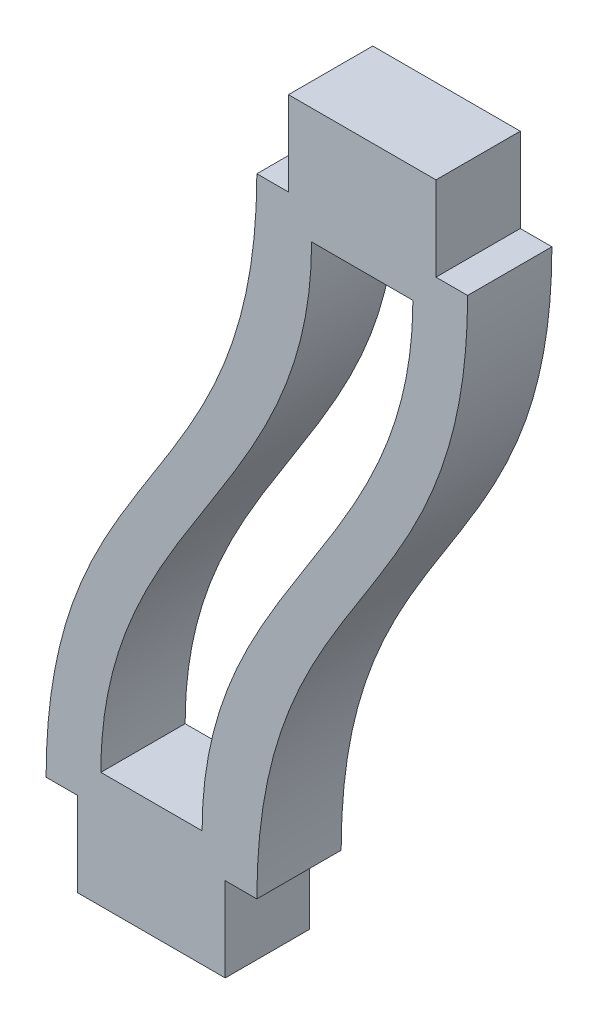
from build123d import *

# Parameters (mm, degrees)
BOSS_EXTRU_1_DEPTH      = 4
ENL_V_MAT_EXTRU_1_REACH = 44.274


with BuildPart() as part:
    # Esquisse1 → Boss.-Extru.1 (new body)
    with BuildSketch(Plane.XY):
        with BuildLine():
            Line((0, 0), (7, 0))
            Line((7, 0), (7, 4))
            Line((7, 4), (8.5, 4))
            add(Edge.make_bspline(
                [(8.5, 4), (8.5, 18.018365096), (18.5, 19.781634904), (18.5, 33.8)],
                knots=[0, 0, 0, 0, 1, 1, 1, 1], degree=3))
            Line((18.5, 33.8), (17, 33.8))
            Line((17, 33.8), (17, 37.8))
            Line((17, 37.8), (10, 37.8))
            Line((10, 37.8), (10, 33.8))
            Line((10, 33.8), (8.5, 33.8))
            add(Edge.make_bspline(
                [(-1.5, 4), (-1.5, 18.018365096), (8.5, 19.781634904), (8.5, 33.8)],
                knots=[0, 0, 0, 0, 1, 1, 1, 1], degree=3))
            Line((-1.5, 4), (0, 4))
            Line((0, 4), (0, 0))
        make_face()
    extrude(amount=BOSS_EXTRU_1_DEPTH)

    # Esquisse2 → Enlèv. mat.-Extru.1 (cut, up to next)
    with BuildSketch(Plane.XY.offset(4), mode=Mode.PRIVATE) as enl_v_mat_extru_1_sk1:
        with BuildLine():
            Line((11.098076211, 32.3), (15.901923789, 32.3))
            add(Edge.make_bspline(
                [(5.901923789, 5.5), (5.901923789, 16.568461709), (15.901923789, 21.231538291), (15.901923789, 32.3)],
                knots=[0, 0, 0, 0, 1, 1, 1, 1], degree=3))
            Line((5.901923789, 5.5), (1.098076211, 5.5))
            add(Edge.make_bspline(
                [(1.098076211, 5.5), (1.098076211, 16.568461709), (11.098076211, 21.231538291), (11.098076211, 32.3)],
                knots=[0, 0, 0, 0, 1, 1, 1, 1], degree=3))
        make_face()
    enl_v_mat_extru_1_tool1 = extrude(enl_v_mat_extru_1_sk1.sketch, amount=-ENL_V_MAT_EXTRU_1_REACH, mode=Mode.PRIVATE) & part.part
    add(enl_v_mat_extru_1_tool1.solids().sort_by_distance((8.5, 18.9, 4))[0], mode=Mode.SUBTRACT)


solid = part.part
